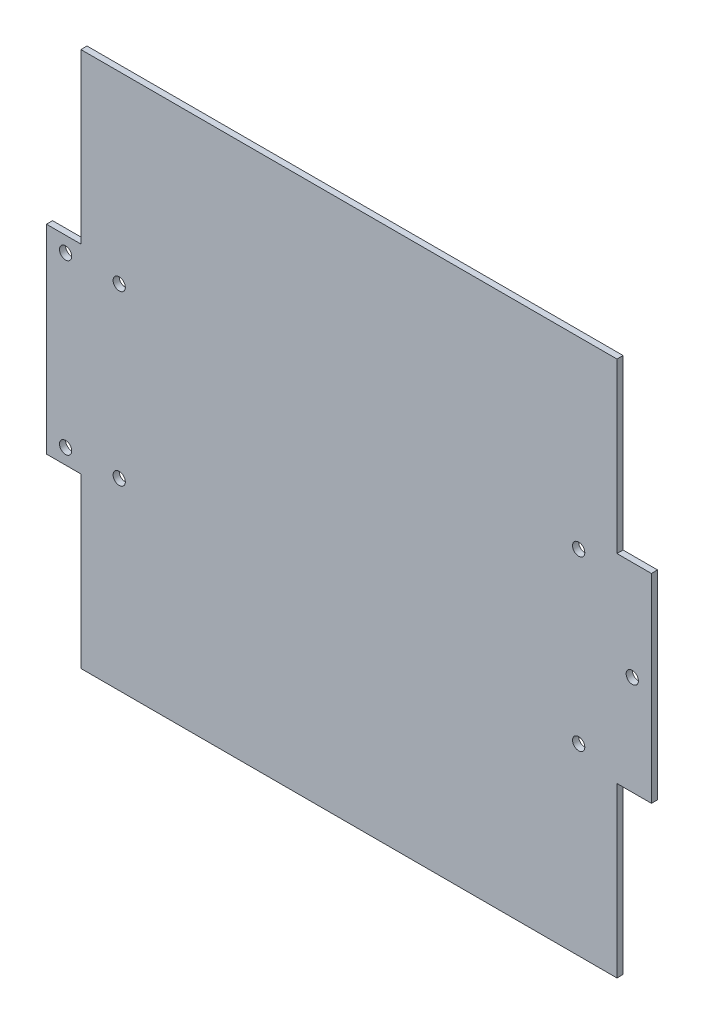
from build123d import *

# Parameters (mm, degrees)
BOSS_EXTRUDE1_DEPTH            = 1.6
F_3_2_3_2_DIAMETER_HOLE1_D     = 3.2
F_3_2_3_2_DIAMETER_HOLE1_DEPTH = 4
F_3_2_3_2_DIAMETER_HOLE1_TIP   = 0.96137699
SKETCH8_R                      = 1.6
CUT_EXTRUDE2_DEPTH             = 205.459189082


with BuildPart() as part:
    # Sketch1 → Boss-Extrude1 (new body)
    with BuildSketch(Plane.XY):
        Polygon((0, 0), (140, 0), (140, 44), (149, 44), (149, 96), (140, 96), (140, 140), (0, 140), (0, 96), (-9, 96), (-9, 44), (0, 44), align=None)
    extrude(amount=BOSS_EXTRUDE1_DEPTH)

    # Ø3.2 (3.2) Diameter Hole1
    with Locations(Plane(origin=(0, 0, 0), x_dir=(-1, 0, 0), z_dir=(0, 0, -1))):
        with Locations((-130, 92), (-130, 48), (-10, 92), (-10, 48)):
            Hole(F_3_2_3_2_DIAMETER_HOLE1_D / 2, depth=F_3_2_3_2_DIAMETER_HOLE1_DEPTH)
            with Locations((0, 0, -(F_3_2_3_2_DIAMETER_HOLE1_DEPTH + F_3_2_3_2_DIAMETER_HOLE1_TIP / 2))):  # 118° drill point
                Cone(0, F_3_2_3_2_DIAMETER_HOLE1_D / 2, F_3_2_3_2_DIAMETER_HOLE1_TIP, mode=Mode.SUBTRACT)

    # Sketch8 → Cut-Extrude2 (cut, through all)
    with BuildSketch(Plane.XY.offset(1.6)):
        with Locations((-4, 92)):
            Circle(SKETCH8_R)
        with Locations((-4, 48)):
            Circle(SKETCH8_R)
        with Locations((144, 70)):
            Circle(SKETCH8_R)
    extrude(amount=-CUT_EXTRUDE2_DEPTH, mode=Mode.SUBTRACT)


solid = part.part
